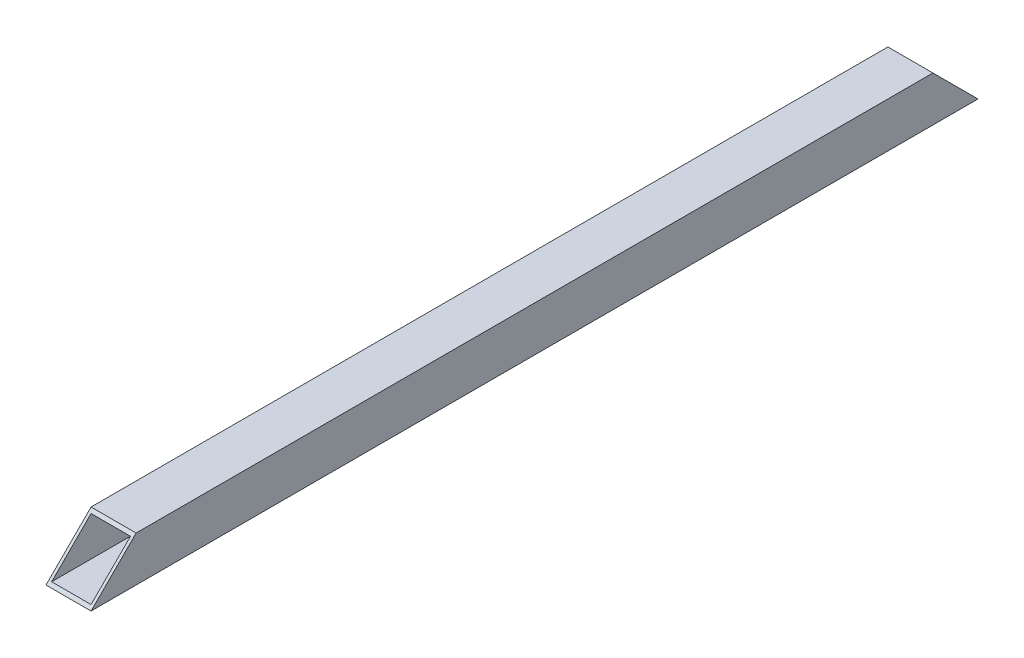
from build123d import *

# Parameters (mm, degrees)
SKETCH1_W           = 25.4
SKETCH1_H           = 25.4
SKETCH1_W_2         = 22.225
SKETCH1_H_2         = 22.225
BOSS_EXTRUDE1_DEPTH = 250
CUT_EXTRUDE1_DEPTH  = 252.607730406


with BuildPart() as part:
    # Sketch1 → Boss-Extrude1 (new, symmetric)
    with BuildSketch(Plane.XY):
        Rectangle(SKETCH1_W, SKETCH1_H)
        Rectangle(SKETCH1_W_2, SKETCH1_H_2, mode=Mode.SUBTRACT)
    extrude(amount=BOSS_EXTRUDE1_DEPTH, both=True)

    # Sketch2 → Cut-Extrude1 (cut, through all)
    with BuildSketch(Plane(origin=(12.7, 0, 0), x_dir=(0, 0, -1), z_dir=(1, 0, 0))):
        Polygon((-250, -12.7), (-250, 12.7), (-224.6, 12.7), align=None)
        Polygon((250, -12.7), (250, 12.7), (224.6, 12.7), align=None)
    extrude(amount=-CUT_EXTRUDE1_DEPTH, mode=Mode.SUBTRACT)


solid = part.part
